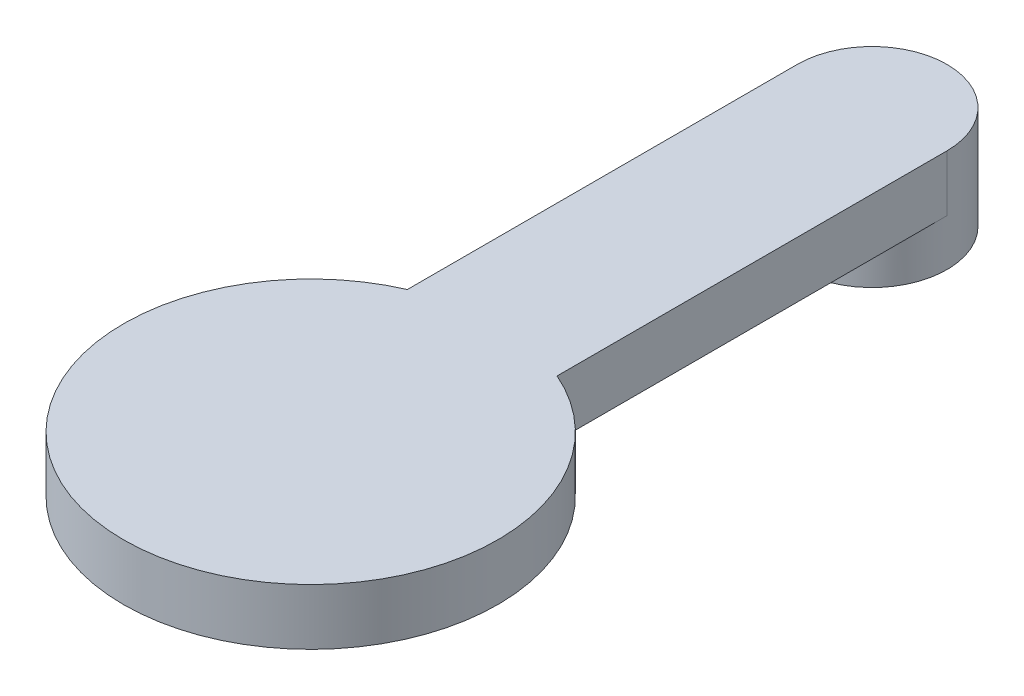
from build123d import *

# Parameters (mm, degrees)
SKETCH_1_R      = 4
EXTRUDE_1_DEPTH = 2.5
EXTRUDE_2_DEPTH = 3


with BuildPart() as part:
    # 草图1 → 凸台-拉伸1 (new body)
    with BuildSketch(Plane(origin=(0, 0, 0), x_dir=(1, 0, 0), z_dir=(0, 1, 0))):
        with Locations(Location((0, 0, 0), (0, 0, 270))):
            Circle(SKETCH_1_R)
        Polygon((0, 3.0022214), (-2.6, 1.5011107), (-2.6, -1.5011107), (0, -3.0022214), (2.6, -1.5011107), (2.6, 1.5011107), align=None, mode=Mode.SUBTRACT)
    extrude(amount=EXTRUDE_1_DEPTH)

    # 草图2 → 凸台-拉伸2 (add)
    with BuildSketch(Plane(origin=(0, 2.5, 0), x_dir=(1, 0, 0), z_dir=(0, 1, 0))):
        with BuildLine():
            Line((4, 0), (4, -20.83484861))
            ThreePointArc((4, -20.83484861), (0, -40), (-4, -20.83484861))
            Line((-4, -20.83484861), (-4, 0))
            ThreePointArc((-4, 0), (0, 4), (4, 0))
        make_face()
    extrude(amount=EXTRUDE_2_DEPTH)


solid = part.part
